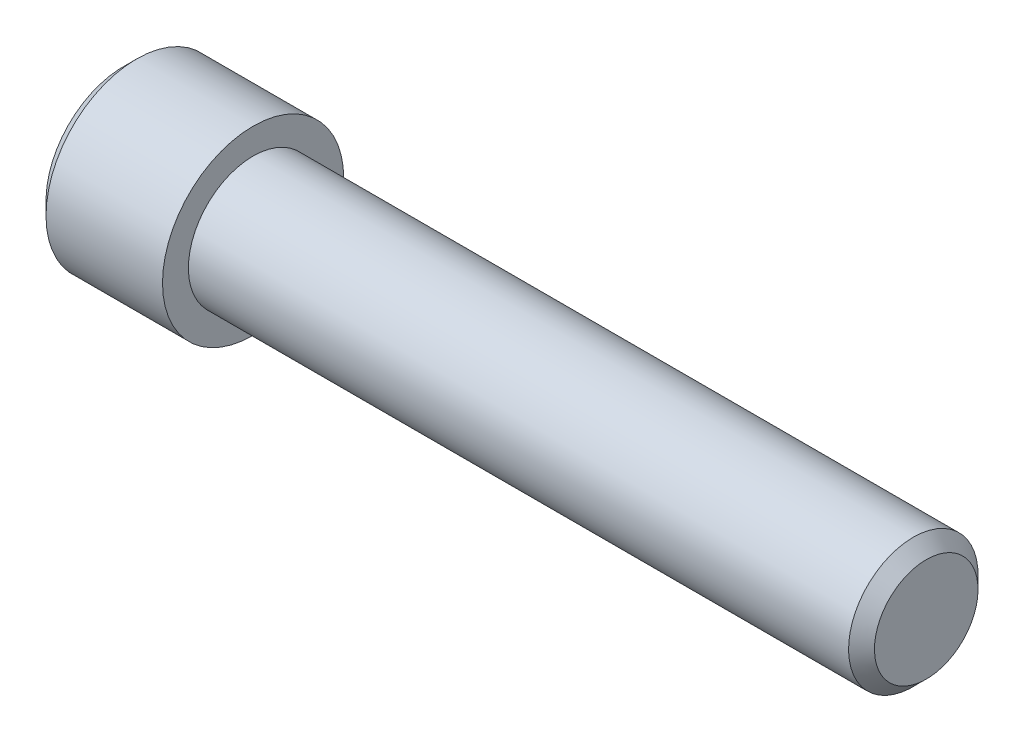
from build123d import *

# Parameters (mm, degrees)
CUT_EXTRUDE1_DEPTH = 3
CHAMFER1_SIZE      = 0.5


with BuildPart() as part:
    # Sketch1 → Revolve1 (revolve)
    with BuildSketch(Plane.XY):
        Polygon((0, 0), (0, 3.5), (5, 3.5), (5, 2.5), (31, 2.5), (31, 0), align=None)
    revolve(axis=Axis((31, 0, 0), (-1, 0, 0)))

    # Sketch2 → Cut-Extrude1 (cut)
    with BuildSketch(Plane.ZY):
        Polygon((0, 2.5), (-2.165063509, 1.25), (-2.165063509, -1.25), (0, -2.5), (2.165063509, -1.25), (2.165063509, 1.25), align=None)
    extrude(amount=-CUT_EXTRUDE1_DEPTH, mode=Mode.SUBTRACT)

    # Chamfer1
    chamfer1_edges = [part.edges().sort_by_distance(p)[0] for p in [
        (31, -2.5, 0),
        (0, -3.5, 0),
    ]]
    chamfer(chamfer1_edges, length=CHAMFER1_SIZE)


solid = part.part
